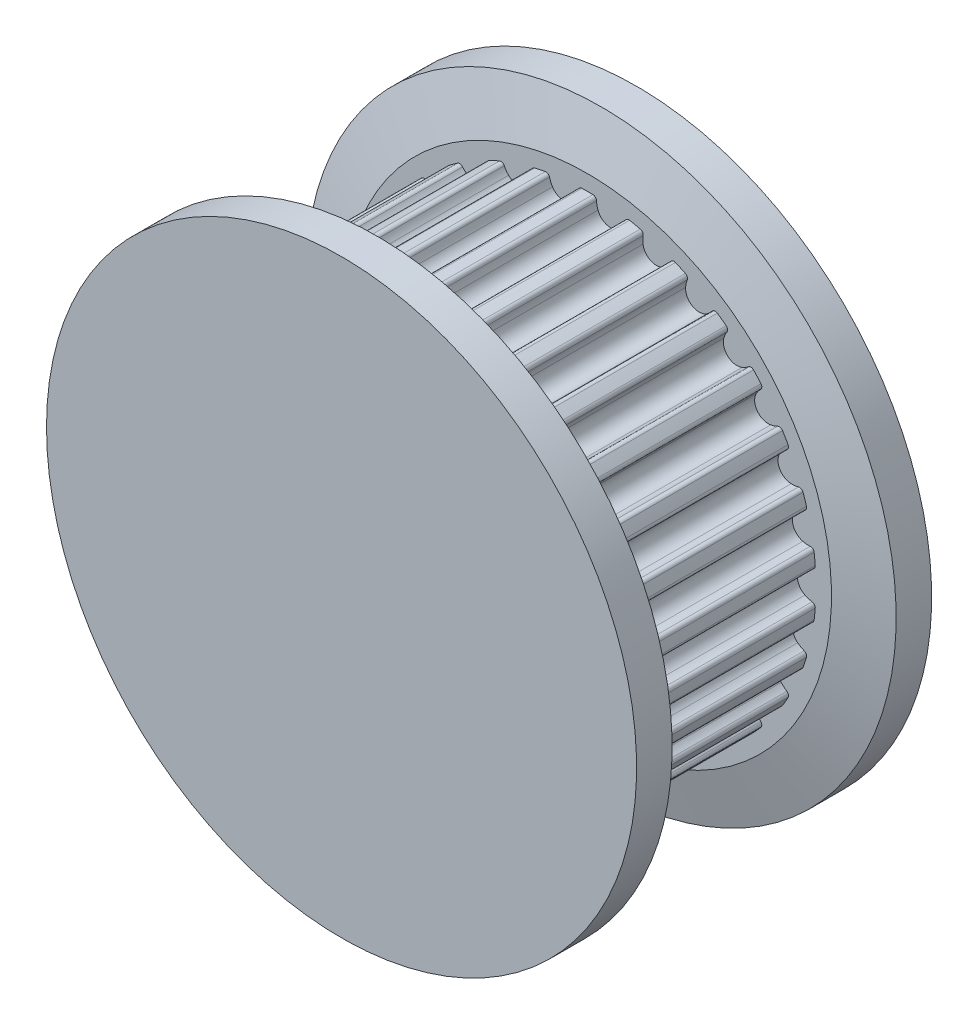
from build123d import *

# Parameters (mm, degrees)
BOSS_EXTRUDE1_DEPTH = 4


with BuildPart() as part:
    # Teeth → Boss-Extrude1 (new, symmetric)
    with BuildSketch(Plane.XY):
        with BuildLine():
            ThreePointArc((9.265037895, -0.749407376), (9.255373868, -0.860577234), (9.244375978, -0.971623068))
            ThreePointArc((9.244375978, -0.971623068), (9.232045811, -1.082528873), (9.218385142, -1.193278668))
            ThreePointArc((9.218385142, -1.193278668), (9.165223738, -1.289612833), (9.060624925, -1.323752174))
            ThreePointArc((9.060624925, -1.323752174), (8.90837436, -1.326213349), (8.758262534, -1.351761965))
            ThreePointArc((8.758262534, -1.351761965), (8.349896739, -1.774825341), (8.550882079, -2.327410299))
            ThreePointArc((8.550882079, -2.327410299), (8.677624497, -2.411806101), (8.815711259, -2.47598038))
            ThreePointArc((8.815711259, -2.47598038), (8.897381309, -2.54971239), (8.906764033, -2.659340721))
            ThreePointArc((8.906764033, -2.659340721), (8.874197675, -2.766071987), (8.840352389, -2.872404613))
            ThreePointArc((8.840352389, -2.872404613), (8.805233051, -2.978323274), (8.768844724, -3.083812707))
            ThreePointArc((8.768844724, -3.083812707), (8.696816025, -3.166988863), (8.587404979, -3.178634861))
            ThreePointArc((8.587404979, -3.178634861), (8.437969747, -3.149387581), (8.285826368, -3.143167895))
            ThreePointArc((8.285826368, -3.143167895), (7.798424524, -3.472082299), (7.880128979, -4.054379151))
            ThreePointArc((7.880128979, -4.054379151), (7.986554897, -4.163281933), (8.10828155, -4.254763702))
            ThreePointArc((8.10828155, -4.254763702), (8.172837166, -4.343864649), (8.159221844, -4.453048116))
            ThreePointArc((8.159221844, -4.453048116), (8.105176461, -4.550676121), (8.049962979, -4.647648293))
            ThreePointArc((8.049962979, -4.647648293), (7.993589355, -4.743950657), (7.936063714, -4.839569334))
            ThreePointArc((7.936063714, -4.839569334), (7.84831572, -4.905952282), (7.738874228, -4.894595952))
            ThreePointArc((7.738874228, -4.894595952), (7.598785366, -4.834918463), (7.451259831, -4.797202305))
            ThreePointArc((7.451259831, -4.797202305), (6.906123737, -5.017592598), (6.86497643, -5.604152179))
            ThreePointArc((6.86497643, -5.604152179), (6.946434525, -5.732802366), (7.046481028, -5.847593434))
            ThreePointArc((7.046481028, -5.847593434), (7.091100821, -5.948169178), (7.055082507, -6.052135939))
            ThreePointArc((7.055082507, -6.052135939), (6.981920142, -6.136393871), (6.907751559, -6.219767441))
            ThreePointArc((6.907751559, -6.219767441), (6.832587447, -6.302244632), (6.756438638, -6.383813558))
            ThreePointArc((6.756438638, -6.383813558), (6.656806357, -6.430502046), (6.552117538, -6.396639713))
            ThreePointArc((6.552117538, -6.396639713), (6.427497601, -6.309140208), (6.291037483, -6.241575955))
            ThreePointArc((6.291037483, -6.241575955), (5.711992203, -6.343810025), (5.549791469, -6.908996865))
            ThreePointArc((5.549791469, -6.908996865), (5.602721631, -7.051771827), (5.676715474, -7.184855272))
            ThreePointArc((5.676715474, -7.184855272), (5.699449344, -7.292510172), (5.642602211, -7.386716381))
            ThreePointArc((5.642602211, -7.386716381), (5.55352041, -7.453921764), (5.463638249, -7.520052905))
            ThreePointArc((5.463638249, -7.520052905), (5.37296868, -7.585100274), (5.281524773, -7.649054496))
            ThreePointArc((5.281524773, -7.649054496), (5.174362614, -7.674008013), (5.079001872, -7.619119624))
            ThreePointArc((5.079001872, -7.619119624), (4.975297349, -7.507622251), (4.85586661, -7.413162786))
            ThreePointArc((4.85586661, -7.413162786), (4.2682192, -7.392772512), (3.99205399, -7.911885235))
            ThreePointArc((3.99205399, -7.911885235), (4.014142917, -8.062545021), (4.058850213, -8.208104459))
            ThreePointArc((4.058850213, -8.208104459), (4.058704581, -8.318133478), (3.983513122, -8.398461872))
            ThreePointArc((3.983513122, -8.398461872), (3.882405187, -8.445677508), (3.78073773, -8.491675973))
            ThreePointArc((3.78073773, -8.491675973), (3.678525401, -8.536450638), (3.575782931, -8.579995049))
            ThreePointArc((3.575782931, -8.579995049), (3.465774395, -8.582123005), (3.383909451, -8.508607446))
            ThreePointArc((3.383909451, -8.508607446), (3.305652729, -8.377985177), (3.208471065, -8.26075883))
            ThreePointArc((3.208471065, -8.26075883), (2.637904537, -8.118635366), (2.259844595, -8.568986255))
            ThreePointArc((2.259844595, -8.568986255), (2.250126896, -8.72094631), (2.263593721, -8.872620093))
            ThreePointArc((2.263593721, -8.872620093), (2.240574952, -8.980214436), (2.150325395, -9.043154279))
            ThreePointArc((2.150325395, -9.043154279), (2.041610228, -9.068316618), (1.93260083, -9.092172053))
            ThreePointArc((1.93260083, -9.092172053), (1.823312909, -9.114717146), (1.713762217, -9.135948647))
            ThreePointArc((1.713762217, -9.135948647), (1.605715204, -9.115158041), (1.54092395, -9.026228295))
            ThreePointArc((1.54092395, -9.026228295), (1.491535222, -8.882189948), (1.420849939, -8.747320074))
            ThreePointArc((1.420849939, -8.747320074), (0.892300788, -8.489674897), (0.428869148, -8.851581456))
            ThreePointArc((0.428869148, -8.851581456), (0.387769532, -8.998200396), (0.369407321, -9.149359654))
            ThreePointArc((0.369407321, -9.149359654), (0.324521446, -9.249816931), (0.223158129, -9.292617449))
            ThreePointArc((0.223158129, -9.292617449), (0.111587106, -9.294626777), (0, -9.295296586))
            ThreePointArc((0, -9.295296586), (-0.111587106, -9.294626777), (-0.22315813, -9.292617449))
            ThreePointArc((-0.22315813, -9.292617449), (-0.324521446, -9.249816931), (-0.369407322, -9.149359654))
            ThreePointArc((-0.369407322, -9.149359654), (-0.387769532, -8.998200396), (-0.428869148, -8.851581456))
            ThreePointArc((-0.428869148, -8.851581456), (-0.892300788, -8.489674897), (-1.420849939, -8.747320074))
            ThreePointArc((-1.420849939, -8.747320074), (-1.491535222, -8.882189948), (-1.54092395, -9.026228295))
            ThreePointArc((-1.54092395, -9.026228295), (-1.605715204, -9.115158041), (-1.713762217, -9.135948647))
            ThreePointArc((-1.713762217, -9.135948647), (-1.823312909, -9.114717146), (-1.93260083, -9.092172053))
            ThreePointArc((-1.93260083, -9.092172053), (-2.041610228, -9.068316618), (-2.150325395, -9.043154279))
            ThreePointArc((-2.150325395, -9.043154279), (-2.240574952, -8.980214436), (-2.263593721, -8.872620093))
            ThreePointArc((-2.263593721, -8.872620093), (-2.250126896, -8.72094631), (-2.259844595, -8.568986255))
            ThreePointArc((-2.259844595, -8.568986255), (-2.637904537, -8.118635366), (-3.208471065, -8.26075883))
            ThreePointArc((-3.208471065, -8.26075883), (-3.305652729, -8.377985177), (-3.383909451, -8.508607446))
            ThreePointArc((-3.383909451, -8.508607446), (-3.465774395, -8.582123005), (-3.575782931, -8.579995049))
            ThreePointArc((-3.575782931, -8.579995049), (-3.678525401, -8.536450638), (-3.78073773, -8.491675973))
            ThreePointArc((-3.78073773, -8.491675973), (-3.882405188, -8.445677508), (-3.983513122, -8.398461872))
            ThreePointArc((-3.983513122, -8.398461872), (-4.058704581, -8.318133478), (-4.058850213, -8.208104459))
            ThreePointArc((-4.058850213, -8.208104459), (-4.014142917, -8.062545021), (-3.99205399, -7.911885235))
            ThreePointArc((-3.99205399, -7.911885235), (-4.2682192, -7.392772512), (-4.85586661, -7.413162786))
            ThreePointArc((-4.85586661, -7.413162786), (-4.975297349, -7.507622251), (-5.079001872, -7.619119624))
            ThreePointArc((-5.079001872, -7.619119624), (-5.174362614, -7.674008013), (-5.281524773, -7.649054496))
            ThreePointArc((-5.281524773, -7.649054496), (-5.372968681, -7.585100274), (-5.463638249, -7.520052905))
            ThreePointArc((-5.463638249, -7.520052905), (-5.55352041, -7.453921764), (-5.642602211, -7.386716381))
            ThreePointArc((-5.642602211, -7.386716381), (-5.699449344, -7.292510172), (-5.676715474, -7.184855272))
            ThreePointArc((-5.676715474, -7.184855272), (-5.602721631, -7.051771827), (-5.549791469, -6.908996865))
            ThreePointArc((-5.549791469, -6.908996865), (-5.711992203, -6.343810025), (-6.291037484, -6.241575955))
            ThreePointArc((-6.291037484, -6.241575955), (-6.427497601, -6.309140208), (-6.552117538, -6.396639713))
            ThreePointArc((-6.552117538, -6.396639713), (-6.656806357, -6.430502046), (-6.756438638, -6.383813558))
            ThreePointArc((-6.756438638, -6.383813558), (-6.832587447, -6.302244632), (-6.907751559, -6.219767441))
            ThreePointArc((-6.907751559, -6.219767441), (-6.981920142, -6.136393871), (-7.055082507, -6.052135939))
            ThreePointArc((-7.055082507, -6.052135939), (-7.091100821, -5.948169178), (-7.046481029, -5.847593434))
            ThreePointArc((-7.046481029, -5.847593434), (-6.946434525, -5.732802366), (-6.86497643, -5.604152179))
            ThreePointArc((-6.86497643, -5.604152179), (-6.906123737, -5.017592598), (-7.451259831, -4.797202305))
            ThreePointArc((-7.451259831, -4.797202305), (-7.598785366, -4.834918463), (-7.738874228, -4.894595952))
            ThreePointArc((-7.738874228, -4.894595952), (-7.84831572, -4.905952282), (-7.936063714, -4.839569334))
            ThreePointArc((-7.936063714, -4.839569334), (-7.993589355, -4.743950657), (-8.049962979, -4.647648293))
            ThreePointArc((-8.049962979, -4.647648293), (-8.105176461, -4.550676121), (-8.159221844, -4.453048116))
            ThreePointArc((-8.159221844, -4.453048116), (-8.172837166, -4.343864649), (-8.10828155, -4.254763702))
            ThreePointArc((-8.10828155, -4.254763702), (-7.986554897, -4.163281933), (-7.880128979, -4.054379151))
            ThreePointArc((-7.880128979, -4.054379151), (-7.798424525, -3.472082299), (-8.285826369, -3.143167895))
            ThreePointArc((-8.285826369, -3.143167895), (-8.437969747, -3.149387581), (-8.587404979, -3.178634861))
            ThreePointArc((-8.587404979, -3.178634861), (-8.696816025, -3.166988863), (-8.768844724, -3.083812707))
            ThreePointArc((-8.768844724, -3.083812707), (-8.805233051, -2.978323274), (-8.840352389, -2.872404613))
            ThreePointArc((-8.840352389, -2.872404613), (-8.874197675, -2.766071987), (-8.906764033, -2.659340721))
            ThreePointArc((-8.906764033, -2.659340721), (-8.897381309, -2.54971239), (-8.815711259, -2.47598038))
            ThreePointArc((-8.815711259, -2.47598038), (-8.677624497, -2.411806101), (-8.550882079, -2.327410299))
            ThreePointArc((-8.550882079, -2.327410299), (-8.34989674, -1.774825341), (-8.758262534, -1.351761965))
            ThreePointArc((-8.758262534, -1.351761965), (-8.90837436, -1.326213349), (-9.060624925, -1.323752174))
            ThreePointArc((-9.060624925, -1.323752174), (-9.165223738, -1.289612833), (-9.218385142, -1.193278668))
            ThreePointArc((-9.218385142, -1.193278668), (-9.232045811, -1.082528873), (-9.244375978, -0.971623068))
            ThreePointArc((-9.244375978, -0.971623068), (-9.255373868, -0.860577234), (-9.265037895, -0.749407376))
            ThreePointArc((-9.265037895, -0.749407376), (-9.233067195, -0.644125465), (-9.137852084, -0.588984835))
            ThreePointArc((-9.137852084, -0.588984835), (-8.989440266, -0.55492277), (-8.8479206, -0.498722449))
            ThreePointArc((-8.8479206, -0.498722449), (-8.5364384, 0), (-8.8479206, 0.498722449))
            ThreePointArc((-8.8479206, 0.498722449), (-8.989440266, 0.55492277), (-9.137852084, 0.588984835))
            ThreePointArc((-9.137852084, 0.588984835), (-9.233067195, 0.644125465), (-9.265037895, 0.749407376))
            ThreePointArc((-9.265037895, 0.749407376), (-9.255373868, 0.860577234), (-9.244375978, 0.971623068))
            ThreePointArc((-9.244375978, 0.971623068), (-9.232045811, 1.082528873), (-9.218385142, 1.193278668))
            ThreePointArc((-9.218385142, 1.193278668), (-9.165223738, 1.289612833), (-9.060624925, 1.323752174))
            ThreePointArc((-9.060624925, 1.323752174), (-8.90837436, 1.326213349), (-8.758262534, 1.351761965))
            ThreePointArc((-8.758262534, 1.351761965), (-8.34989674, 1.774825341), (-8.550882079, 2.327410299))
            ThreePointArc((-8.550882079, 2.327410299), (-8.677624497, 2.411806101), (-8.815711259, 2.47598038))
            ThreePointArc((-8.815711259, 2.47598038), (-8.897381309, 2.54971239), (-8.906764033, 2.659340721))
            ThreePointArc((-8.906764033, 2.659340721), (-8.874197675, 2.766071987), (-8.840352389, 2.872404613))
            ThreePointArc((-8.840352389, 2.872404613), (-8.805233051, 2.978323274), (-8.768844724, 3.083812707))
            ThreePointArc((-8.768844724, 3.083812707), (-8.696816025, 3.166988863), (-8.587404979, 3.178634861))
            ThreePointArc((-8.587404979, 3.178634861), (-8.437969747, 3.149387581), (-8.285826369, 3.143167895))
            ThreePointArc((-8.285826369, 3.143167895), (-7.798424525, 3.472082299), (-7.880128979, 4.054379151))
            ThreePointArc((-7.880128979, 4.054379151), (-7.986554897, 4.163281933), (-8.10828155, 4.254763702))
            ThreePointArc((-8.10828155, 4.254763702), (-8.172837166, 4.343864649), (-8.159221844, 4.453048116))
            ThreePointArc((-8.159221844, 4.453048116), (-8.105176461, 4.550676121), (-8.049962979, 4.647648293))
            ThreePointArc((-8.049962979, 4.647648293), (-7.993589355, 4.743950657), (-7.936063714, 4.839569334))
            ThreePointArc((-7.936063714, 4.839569334), (-7.84831572, 4.905952282), (-7.738874228, 4.894595952))
            ThreePointArc((-7.738874228, 4.894595952), (-7.598785366, 4.834918463), (-7.451259831, 4.797202305))
            ThreePointArc((-7.451259831, 4.797202305), (-6.906123737, 5.017592598), (-6.86497643, 5.604152179))
            ThreePointArc((-6.86497643, 5.604152179), (-6.946434525, 5.732802366), (-7.046481029, 5.847593434))
            ThreePointArc((-7.046481029, 5.847593434), (-7.091100821, 5.948169178), (-7.055082507, 6.052135939))
            ThreePointArc((-7.055082507, 6.052135939), (-6.981920142, 6.136393871), (-6.907751559, 6.219767441))
            ThreePointArc((-6.907751559, 6.219767441), (-6.832587447, 6.302244632), (-6.756438638, 6.383813558))
            ThreePointArc((-6.756438638, 6.383813558), (-6.656806357, 6.430502046), (-6.552117538, 6.396639713))
            ThreePointArc((-6.552117538, 6.396639713), (-6.427497601, 6.309140208), (-6.291037484, 6.241575955))
            ThreePointArc((-6.291037484, 6.241575955), (-5.711992203, 6.343810025), (-5.549791469, 6.908996865))
            ThreePointArc((-5.549791469, 6.908996865), (-5.602721631, 7.051771827), (-5.676715474, 7.184855272))
            ThreePointArc((-5.676715474, 7.184855272), (-5.699449344, 7.292510172), (-5.642602211, 7.386716381))
            ThreePointArc((-5.642602211, 7.386716381), (-5.55352041, 7.453921764), (-5.463638249, 7.520052905))
            ThreePointArc((-5.463638249, 7.520052905), (-5.372968681, 7.585100274), (-5.281524773, 7.649054496))
            ThreePointArc((-5.281524773, 7.649054496), (-5.174362614, 7.674008013), (-5.079001872, 7.619119624))
            ThreePointArc((-5.079001872, 7.619119624), (-4.975297349, 7.507622251), (-4.85586661, 7.413162786))
            ThreePointArc((-4.85586661, 7.413162786), (-4.2682192, 7.392772512), (-3.99205399, 7.911885235))
            ThreePointArc((-3.99205399, 7.911885235), (-4.014142917, 8.062545021), (-4.058850213, 8.208104459))
            ThreePointArc((-4.058850213, 8.208104459), (-4.058704581, 8.318133478), (-3.983513122, 8.398461872))
            ThreePointArc((-3.983513122, 8.398461872), (-3.882405188, 8.445677508), (-3.78073773, 8.491675973))
            ThreePointArc((-3.78073773, 8.491675973), (-3.678525401, 8.536450638), (-3.575782931, 8.579995049))
            ThreePointArc((-3.575782931, 8.579995049), (-3.465774395, 8.582123005), (-3.383909451, 8.508607446))
            ThreePointArc((-3.383909451, 8.508607446), (-3.305652729, 8.377985177), (-3.208471065, 8.26075883))
            ThreePointArc((-3.208471065, 8.26075883), (-2.637904537, 8.118635366), (-2.259844595, 8.568986255))
            ThreePointArc((-2.259844595, 8.568986255), (-2.250126896, 8.72094631), (-2.263593721, 8.872620093))
            ThreePointArc((-2.263593721, 8.872620093), (-2.240574952, 8.980214436), (-2.150325395, 9.043154279))
            ThreePointArc((-2.150325395, 9.043154279), (-2.041610228, 9.068316618), (-1.93260083, 9.092172053))
            ThreePointArc((-1.93260083, 9.092172053), (-1.823312909, 9.114717146), (-1.713762217, 9.135948647))
            ThreePointArc((-1.713762217, 9.135948647), (-1.605715204, 9.115158041), (-1.54092395, 9.026228295))
            ThreePointArc((-1.54092395, 9.026228295), (-1.491535222, 8.882189948), (-1.420849939, 8.747320074))
            ThreePointArc((-1.420849939, 8.747320074), (-0.892300788, 8.489674897), (-0.428869148, 8.851581456))
            ThreePointArc((-0.428869148, 8.851581456), (-0.387769532, 8.998200396), (-0.369407322, 9.149359654))
            ThreePointArc((-0.369407322, 9.149359654), (-0.324521446, 9.249816931), (-0.22315813, 9.292617449))
            ThreePointArc((-0.22315813, 9.292617449), (-0.111587106, 9.294626777), (0, 9.295296586))
            ThreePointArc((0, 9.295296586), (0.111587106, 9.294626777), (0.223158129, 9.292617449))
            ThreePointArc((0.223158129, 9.292617449), (0.324521446, 9.249816931), (0.369407321, 9.149359654))
            ThreePointArc((0.369407321, 9.149359654), (0.387769532, 8.998200396), (0.428869148, 8.851581456))
            ThreePointArc((0.428869148, 8.851581456), (0.892300788, 8.489674897), (1.420849939, 8.747320074))
            ThreePointArc((1.420849939, 8.747320074), (1.491535222, 8.882189948), (1.54092395, 9.026228295))
            ThreePointArc((1.54092395, 9.026228295), (1.605715204, 9.115158041), (1.713762217, 9.135948647))
            ThreePointArc((1.713762217, 9.135948647), (1.823312909, 9.114717146), (1.93260083, 9.092172053))
            ThreePointArc((1.93260083, 9.092172053), (2.041610228, 9.068316618), (2.150325395, 9.043154279))
            ThreePointArc((2.150325395, 9.043154279), (2.240574952, 8.980214436), (2.263593721, 8.872620093))
            ThreePointArc((2.263593721, 8.872620093), (2.250126896, 8.72094631), (2.259844595, 8.568986255))
            ThreePointArc((2.259844595, 8.568986255), (2.637904537, 8.118635366), (3.208471065, 8.26075883))
            ThreePointArc((3.208471065, 8.26075883), (3.305652729, 8.377985177), (3.383909451, 8.508607446))
            ThreePointArc((3.383909451, 8.508607446), (3.465774395, 8.582123005), (3.575782931, 8.579995049))
            ThreePointArc((3.575782931, 8.579995049), (3.678525401, 8.536450638), (3.78073773, 8.491675973))
            ThreePointArc((3.78073773, 8.491675973), (3.882405187, 8.445677508), (3.983513122, 8.398461872))
            ThreePointArc((3.983513122, 8.398461872), (4.058704581, 8.318133478), (4.058850213, 8.208104459))
            ThreePointArc((4.058850213, 8.208104459), (4.014142917, 8.062545021), (3.99205399, 7.911885235))
            ThreePointArc((3.99205399, 7.911885235), (4.2682192, 7.392772512), (4.85586661, 7.413162786))
            ThreePointArc((4.85586661, 7.413162786), (4.975297349, 7.507622251), (5.079001872, 7.619119624))
            ThreePointArc((5.079001872, 7.619119624), (5.174362614, 7.674008013), (5.281524773, 7.649054496))
            ThreePointArc((5.281524773, 7.649054496), (5.37296868, 7.585100274), (5.463638249, 7.520052905))
            ThreePointArc((5.463638249, 7.520052905), (5.55352041, 7.453921764), (5.642602211, 7.386716381))
            ThreePointArc((5.642602211, 7.386716381), (5.699449344, 7.292510172), (5.676715474, 7.184855272))
            ThreePointArc((5.676715474, 7.184855272), (5.602721631, 7.051771827), (5.549791469, 6.908996865))
            ThreePointArc((5.549791469, 6.908996865), (5.711992203, 6.343810025), (6.291037483, 6.241575955))
            ThreePointArc((6.291037483, 6.241575955), (6.427497601, 6.309140208), (6.552117538, 6.396639713))
            ThreePointArc((6.552117538, 6.396639713), (6.656806357, 6.430502046), (6.756438638, 6.383813558))
            ThreePointArc((6.756438638, 6.383813558), (6.832587447, 6.302244632), (6.907751559, 6.219767441))
            ThreePointArc((6.907751559, 6.219767441), (6.981920142, 6.136393871), (7.055082507, 6.052135939))
            ThreePointArc((7.055082507, 6.052135939), (7.091100821, 5.948169178), (7.046481028, 5.847593434))
            ThreePointArc((7.046481028, 5.847593434), (6.946434525, 5.732802366), (6.86497643, 5.604152179))
            ThreePointArc((6.86497643, 5.604152179), (6.906123737, 5.017592598), (7.451259831, 4.797202305))
            ThreePointArc((7.451259831, 4.797202305), (7.598785366, 4.834918463), (7.738874228, 4.894595952))
            ThreePointArc((7.738874228, 4.894595952), (7.84831572, 4.905952282), (7.936063714, 4.839569334))
            ThreePointArc((7.936063714, 4.839569334), (7.993589355, 4.743950657), (8.049962979, 4.647648293))
            ThreePointArc((8.049962979, 4.647648293), (8.105176461, 4.550676121), (8.159221844, 4.453048116))
            ThreePointArc((8.159221844, 4.453048116), (8.172837166, 4.343864649), (8.10828155, 4.254763702))
            ThreePointArc((8.10828155, 4.254763702), (7.986554897, 4.163281933), (7.880128979, 4.054379151))
            ThreePointArc((7.880128979, 4.054379151), (7.798424524, 3.472082299), (8.285826368, 3.143167895))
            ThreePointArc((8.285826368, 3.143167895), (8.437969747, 3.149387581), (8.587404979, 3.178634861))
            ThreePointArc((8.587404979, 3.178634861), (8.696816025, 3.166988863), (8.768844724, 3.083812707))
            ThreePointArc((8.768844724, 3.083812707), (8.805233051, 2.978323274), (8.840352389, 2.872404613))
            ThreePointArc((8.840352389, 2.872404613), (8.874197675, 2.766071987), (8.906764033, 2.659340721))
            ThreePointArc((8.906764033, 2.659340721), (8.897381309, 2.54971239), (8.815711259, 2.47598038))
            ThreePointArc((8.815711259, 2.47598038), (8.677624497, 2.411806101), (8.550882079, 2.327410299))
            ThreePointArc((8.550882079, 2.327410299), (8.349896739, 1.774825341), (8.758262534, 1.351761965))
            ThreePointArc((8.758262534, 1.351761965), (8.90837436, 1.326213349), (9.060624925, 1.323752174))
            ThreePointArc((9.060624925, 1.323752174), (9.165223738, 1.289612833), (9.218385142, 1.193278668))
            ThreePointArc((9.218385142, 1.193278668), (9.232045811, 1.082528873), (9.244375978, 0.971623068))
            ThreePointArc((9.244375978, 0.971623068), (9.255373868, 0.860577234), (9.265037895, 0.749407376))
            ThreePointArc((9.265037895, 0.749407376), (9.233067195, 0.644125465), (9.137852084, 0.588984835))
            ThreePointArc((9.137852084, 0.588984835), (8.989440266, 0.55492277), (8.8479206, 0.498722449))
            ThreePointArc((8.8479206, 0.498722449), (8.5364384, 0), (8.8479206, -0.498722449))
            ThreePointArc((8.8479206, -0.498722449), (8.989440266, -0.55492277), (9.137852084, -0.588984835))
            ThreePointArc((9.137852084, -0.588984835), (9.233067195, -0.644125465), (9.265037895, -0.749407376))
        make_face()
    extrude(amount=BOSS_EXTRUDE1_DEPTH, both=True)

    # Sketch3 → Revolve1 (revolve)
    with BuildSketch(Plane(origin=(0, 0, 0), x_dir=(0, 0, -1), z_dir=(1, 0, 0))):
        Polygon((-4, 0), (-4, 9.925296586), (-4.555915104, 12), (-6, 12), (-6, 0), align=None)
        Polygon((4, 0), (6, 0), (6, 12), (4.555915104, 12), (4, 9.925296586), align=None)
    revolve(axis=Axis((0, 0, -4), (0, 0, 1)))


solid = part.part
